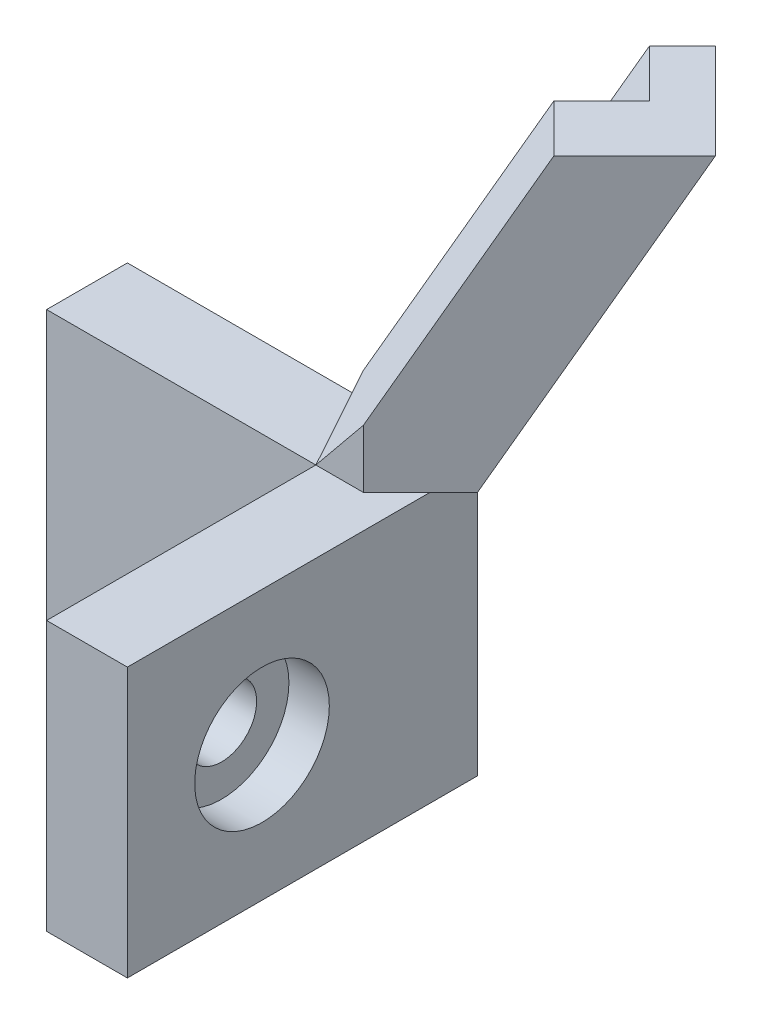
from build123d import *

# Parameters (mm, degrees)
EXTRUDE_2_DEPTH     = 20
CUT_EXTRUDE_1_DEPTH = 20
SKETCH_3_R          = 5
CUT_EXTRUDE_2_DEPTH = 3
SKETCH_4_W          = 6
SKETCH_4_H          = 6
EXTRUDE_3_DEPTH     = 84
CUT_EXTRUDE_3_DEPTH = 84
CUT_EXTRUDE_4_DEPTH = 84
CUT_EXTRUDE_5_DEPTH = 84
SKETCH_9_R          = 1.5
EXTRUDE_4_DEPTH     = 3
CUT_EXTRUDE_6_DEPTH = 6
CUT_EXTRUDE_7_DEPTH = 2.5


with BuildPart() as part:
    # 草图1 → 凸台-拉伸2 (new body)
    with BuildSketch(Plane(origin=(0, 0, 0), x_dir=(1, 0, 0), z_dir=(0, 1, 0))):
        Polygon((0, 0), (0, -20), (6, -20), (6, 6), (-20, 6), (-20, 0), align=None)
    extrude(amount=EXTRUDE_2_DEPTH)

    # 草图2 → 切除-拉伸1 (cut)
    with BuildSketch(Plane(origin=(6, 0, 0), x_dir=(0, 0, -1), z_dir=(1, 0, 0))):
        with BuildLine():
            ThreePointArc((-11.838477631, 11.838477631), (-11.838477631, 8.161522369), (-8.161522369, 8.161522369))
            Line((-8.161522369, 8.161522369), (-11.838477631, 11.838477631))
        make_face()
        with BuildLine():
            Line((-11.838477631, 11.838477631), (-8.161522369, 8.161522369))
            ThreePointArc((-8.161522369, 8.161522369), (-7.597913215, 9.005023076), (-7.4, 10))
            ThreePointArc((-7.4, 10), (-9.005023076, 12.402086785), (-11.838477631, 11.838477631))
        make_face()
    extrude(amount=-CUT_EXTRUDE_1_DEPTH, mode=Mode.SUBTRACT)

    # 草图3 → 切除-拉伸2 (cut)
    with BuildSketch(Plane(origin=(6, 0, 0), x_dir=(0, 0, -1), z_dir=(1, 0, 0))):
        with Locations((-10, 10)):
            Circle(SKETCH_3_R)
    extrude(amount=-CUT_EXTRUDE_2_DEPTH, mode=Mode.SUBTRACT)

    # 草图4 → 凸台-拉伸3 (add)
    with BuildSketch(Plane(origin=(0, 20, 0), x_dir=(1, 0, 0), z_dir=(0, 1, 0))):
        Polygon((65.39696962, 65.39696962), (6, 6), (7.767766953, 4.232233047), (67.164736573, 63.629202667), align=None)
        Polygon((4.232233047, 7.767766953), (6, 6), (65.39696962, 65.39696962), (63.629202667, 67.164736573), align=None)
        Polygon((0, 6), (6, 6), (4.232233047, 7.767766953), (0, 12), align=None)
        with Locations((3, 3)):
            Rectangle(SKETCH_4_W, SKETCH_4_H)
        Polygon((7.767766953, 4.232233047), (6, 6), (6, 0), (12, 0), align=None)
    extrude(amount=EXTRUDE_3_DEPTH)

    # 草图5 → 切除-拉伸3 (cut)
    with BuildSketch(Plane(origin=(-1.767766953, 0, -1.767766953), x_dir=(-0.7071067811865438, 0, 0.7071067811865513), z_dir=(-0.7071067811865513, 0, -0.7071067811865438))):
        Polygon((-8.485281374, 104), (-92.485281374, 104), (-92.485281374, 20), (-8.485281374, 20), (-20.985281374, 41.650635095), (-12.5, 41.650635095), (-8.485281374, 34.696938457), align=None)
        Polygon((0, 104), (-8.485281374, 104), (-8.485281374, 34.696938457), (0, 20), align=None)
    extrude(amount=-CUT_EXTRUDE_3_DEPTH, mode=Mode.SUBTRACT)

    # 草图6 → 切除-拉伸4 (cut)
    with BuildSketch(Plane(origin=(1.767766953, 0, 1.767766953), x_dir=(0.7071067811865438, 0, -0.7071067811865513), z_dir=(0.7071067811865513, 0, 0.7071067811865438))):
        Polygon((8.485281374, 34.696938457), (8.485281374, 20), (0, 20), align=None)
    extrude(amount=CUT_EXTRUDE_4_DEPTH, mode=Mode.SUBTRACT)

    # 草图7 → 切除-拉伸5 (cut)
    with BuildSketch(Plane(origin=(-1.767766953, 0, -1.767766953), x_dir=(-0.7071067811865438, 0, 0.7071067811865513), z_dir=(-0.7071067811865513, 0, -0.7071067811865438))):
        Polygon((-8.485281374, 20), (-2.5, 20), (-2.5, 24.330127019), (-2.5, 104), (-8.485281374, 104), (-8.485281374, 34.696938457), align=None)
        Polygon((-2.5, 24.330127019), (-2.5, 20), (0, 20), align=None)
    extrude(amount=CUT_EXTRUDE_5_DEPTH, mode=Mode.SUBTRACT)

    # 草图9 → 凸台-拉伸4 (add)
    with BuildSketch(Plane(origin=(-1.623724357, 1.325765386, 1.623724357), x_dir=(-0.47434164902525855, 0.3872983346207449, -0.7905694150420924), z_dir=(0.6123724356957914, -0.5, -0.6123724356957978))):
        Polygon((23.059741154, 40.529312363), (27.531877109, 38.293244386), (18.587605199, 20.404700566), (14.115469244, 22.640768543), align=None)
        with Locations(Location((20.823673176, 30.467006465, 0), (0, 0, 333.434948823))):
            Circle(SKETCH_9_R, mode=Mode.SUBTRACT)
    extrude(amount=-EXTRUDE_4_DEPTH)

    # 草图10 → 切除-拉伸6 (cut)
    with BuildSketch(Plane(origin=(-1.767766953, 0, -1.767766953), x_dir=(0.7071067811865438, 0, -0.7071067811865512), z_dir=(0.7071067811865512, 0, 0.7071067811865438))):
        Polygon((17.521179759, 41.650635095), (20.985281374, 41.650635095), (18.387205163, 43.150635095), align=None)
    extrude(amount=-CUT_EXTRUDE_6_DEPTH, mode=Mode.SUBTRACT)

    # 草图11 → 切除-拉伸7 (cut)
    with BuildSketch(Plane(origin=(-1.767766953, 0, -1.767766953), x_dir=(-0.7071067811865438, 0, 0.7071067811865513), z_dir=(-0.7071067811865513, 0, -0.7071067811865438))):
        Polygon((-8.387205163, 25.830127019), (-5.021179759, 20), (-8.485281374, 20), (-10.985281374, 24.330127019), align=None)
    extrude(amount=-CUT_EXTRUDE_7_DEPTH, mode=Mode.SUBTRACT)


solid = part.part
